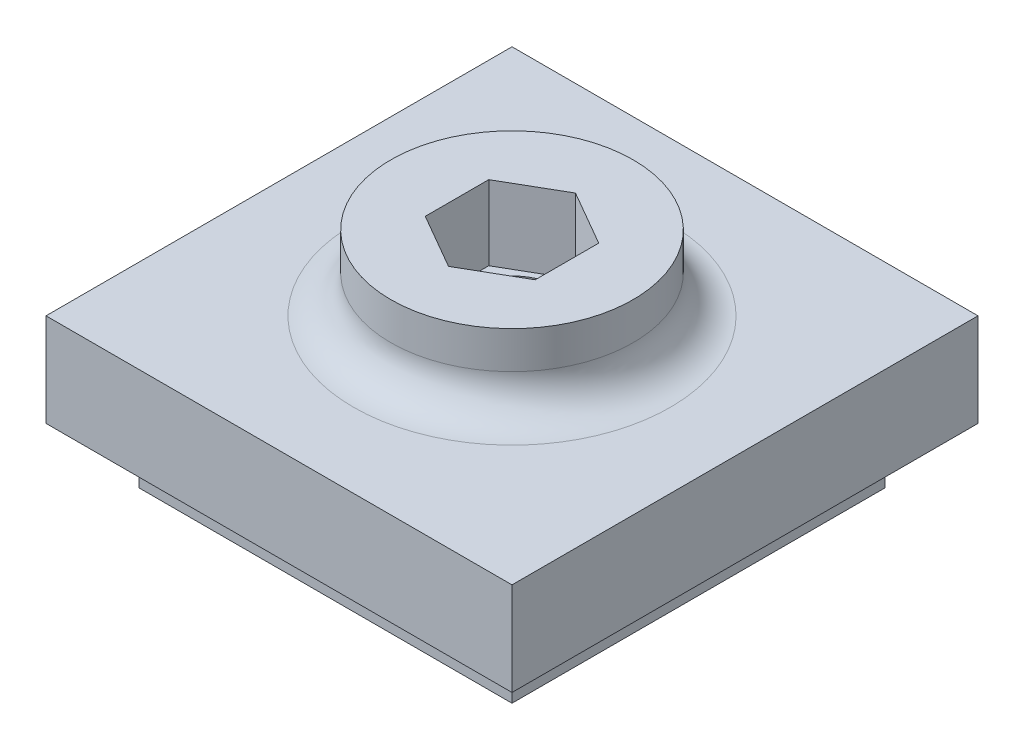
from build123d import *

# Parameters (mm, degrees)
SKETCH2_W               = 25
SKETCH2_H               = 25
BOSS_EXTRUDE1_DEPTH     = 5
SKETCH3_W               = 20
SKETCH3_H               = 20
BOSS_EXTRUDE2_DEPTH     = 3
SKETCH4_R               = 6.5
BOSS_EXTRUDE3_DEPTH     = 4
CUT_EXTRUDE1_DEPTH      = 22.365860619
CUT_EXTRUDE1_DEPTH_BACK = 22.365860619
SKETCH5_R               = 2.62
CUT_EXTRUDE2_DEPTH      = 4
FILLET1_R               = 2


with BuildPart() as part:
    # Sketch2 → Boss-Extrude1 (new body)
    with BuildSketch(Plane(origin=(0, 0, 0), x_dir=(1, 0, 0), z_dir=(0, 1, 0))):
        Rectangle(SKETCH2_W, SKETCH2_H)
    extrude(amount=BOSS_EXTRUDE1_DEPTH)

    # Sketch3 → Boss-Extrude2 (add)
    with BuildSketch(Plane.XZ):
        Rectangle(SKETCH3_W, SKETCH3_H)
    extrude(amount=BOSS_EXTRUDE2_DEPTH)

    # Sketch4 → Boss-Extrude3 (add)
    with BuildSketch(Plane(origin=(0, 5, 0), x_dir=(1, 0, 0), z_dir=(0, 1, 0))):
        with Locations(Location((0, 0, 0), (0, 0, 270))):
            Circle(SKETCH4_R)
    extrude(amount=BOSS_EXTRUDE3_DEPTH)

    # Sketch5 → Cut-Extrude1 (cut, two sides: drawn at the far end of the back side and taken through both)
    with BuildSketch(Plane(origin=(0, 9, 0), x_dir=(1, 0, 0), z_dir=(0, 1, 0)).offset(-CUT_EXTRUDE1_DEPTH_BACK)):
        with Locations(Location((0, 0, 0), (0, 0, 270))):
            Circle(SKETCH5_R)
    extrude(amount=CUT_EXTRUDE1_DEPTH + CUT_EXTRUDE1_DEPTH_BACK, mode=Mode.SUBTRACT)

    # Sketch6 → Cut-Extrude2 (cut)
    with BuildSketch(Plane(origin=(0, 9, 0), x_dir=(1, 0, 0), z_dir=(0, 1, 0))):
        Polygon((0, 3.406366588), (-2.95, 1.703183294), (-2.95, -1.703183294), (0, -3.406366588), (2.95, -1.703183294), (2.95, 1.703183294), align=None)
    extrude(amount=-CUT_EXTRUDE2_DEPTH, mode=Mode.SUBTRACT)

    # Fillet1
    fillet1_edges = [part.edges().sort_by_distance(p)[0] for p in [
        (0, 5, -6.5),
    ]]
    fillet(fillet1_edges, radius=FILLET1_R)


solid = part.part
